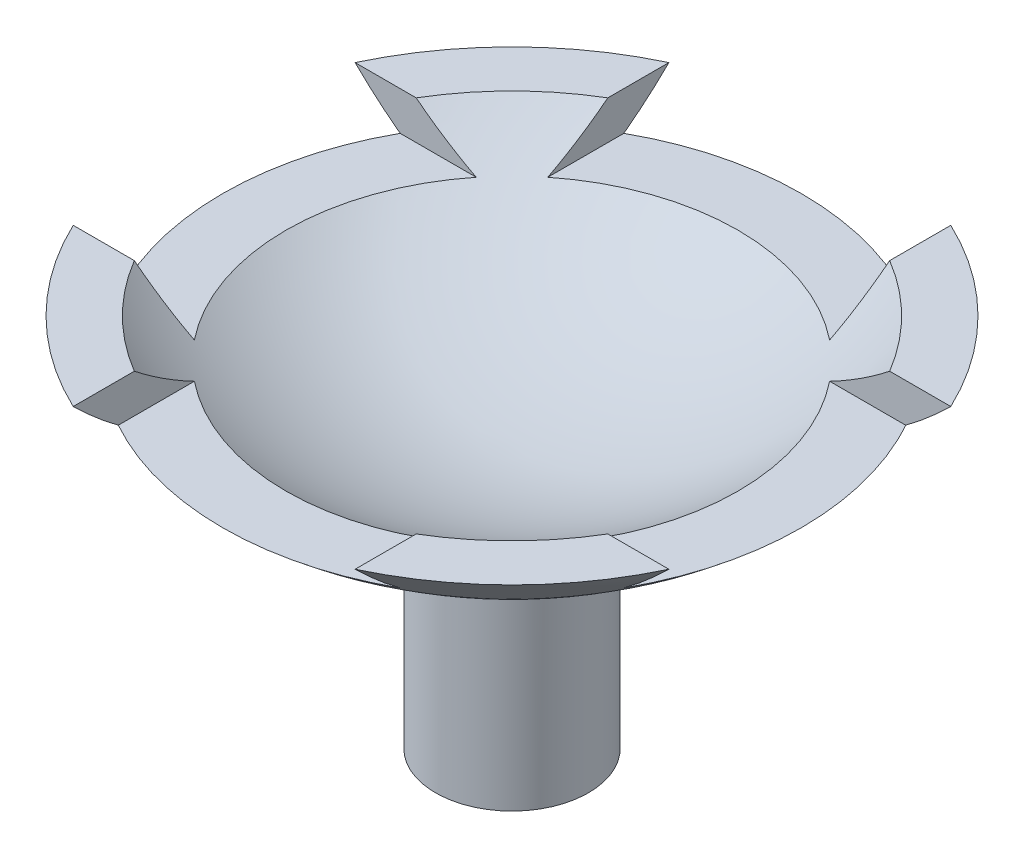
from build123d import *

# Parameters (mm, degrees)
CUT_EXTRUDE1_START = -10
SKETCH2_W          = 22.11
SKETCH2_H          = 3.04
CUT_EXTRUDE1_DEPTH = 57.908847779
CIRPATTERN1_COUNT  = 4
FILLET1_R          = 1.5


with BuildPart() as part:
    # Sketch1 → Revolve1 (revolve)
    with BuildSketch(Plane.XY):
        with BuildLine():
            Line((0, 0), (0, 21))
            ThreePointArc((0, 21), (11.593101397, 23.173836988), (21.611108255, 29.4))
            Line((21.611108255, 29.4), (25.846469778, 29.4))
            ThreePointArc((25.846469778, 29.4), (16.827157621, 22.310477905), (6, 18.518120701))
            Line((6, 18.518120701), (6, 0))
            Line((6, 0), (0, 0))
        make_face()
    revolve(axis=Axis((0, 0, 0), (0, 1, 0)))

    # Sketch2 → Cut-Extrude1 (cut)
    with BuildSketch(Plane.XY.offset(CUT_EXTRUDE1_START)):
        with Locations((0, 27.88)):
            Rectangle(SKETCH2_W, SKETCH2_H)
    cut_extrude1 = extrude(amount=CUT_EXTRUDE1_DEPTH, mode=Mode.SUBTRACT)

    # CirPattern1: Cut-Extrude1 ×4 about axis
    cirpattern1_axis = Axis((0, 0, 0), (0, 1, 0))
    for i in range(1, CIRPATTERN1_COUNT):
        add(cut_extrude1.rotate(cirpattern1_axis, i * 360 / CIRPATTERN1_COUNT), mode=Mode.SUBTRACT)

    # Fillet1
    fillet1_edges = [part.edges().sort_by_distance(p)[0] for p in [
        (-6, 18.518120701, 0),
    ]]
    fillet(fillet1_edges, radius=FILLET1_R)


solid = part.part
